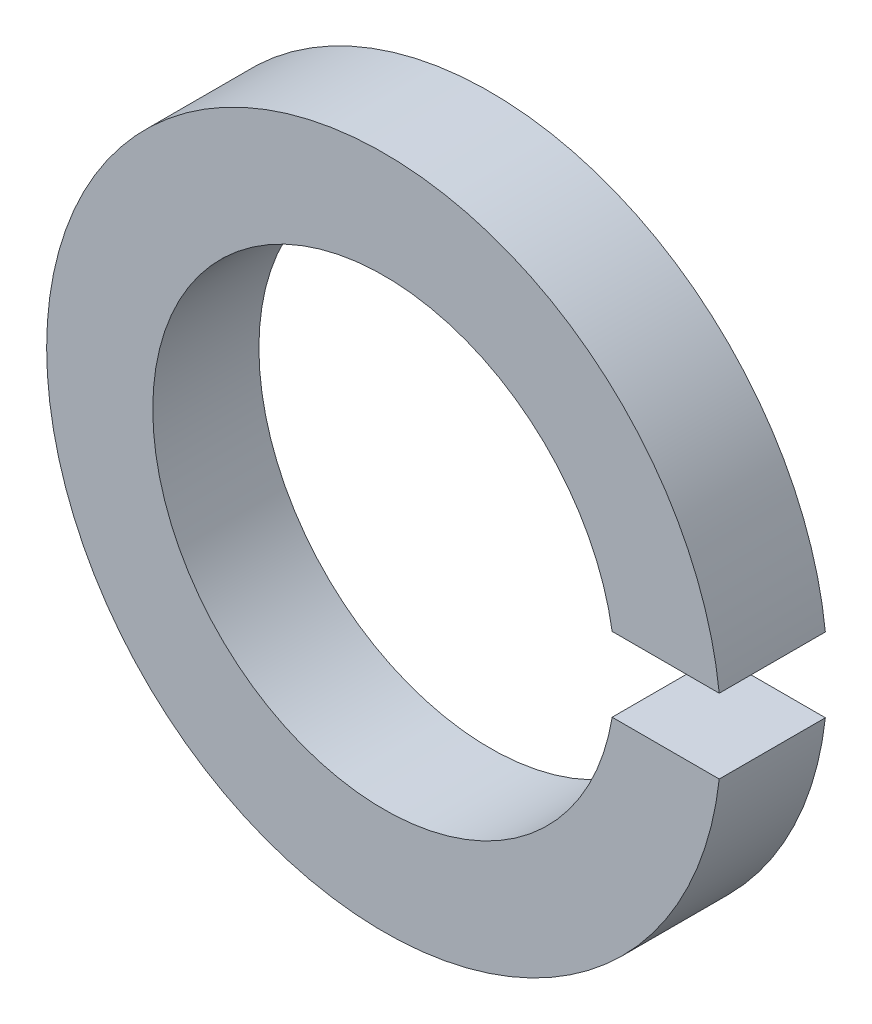
from build123d import *

# Parameters (mm, degrees)
SKETCH_1_R          = 4.45
SKETCH_1_R_2        = 3.05
EXTRUDE_1_DEPTH     = 1.4
SKETCH_2_W          = 1.528827716
SKETCH_2_H          = 0.98
CUT_EXTRUDE_1_DEPTH = 7.447092368


with BuildPart() as part:
    # Эскиз1 → Вытянуть1 (new body)
    with BuildSketch(Plane.XY):
        Circle(SKETCH_1_R)
        Circle(SKETCH_1_R_2, mode=Mode.SUBTRACT)
    extrude(amount=EXTRUDE_1_DEPTH)

    # Эскиз2 → Вырез-Вытянуть1 (cut, through all)
    with BuildSketch(Plane.XY.offset(1.4)):
        with Locations((3.759899488, 0)):
            Rectangle(SKETCH_2_W, SKETCH_2_H)
    extrude(amount=-CUT_EXTRUDE_1_DEPTH, mode=Mode.SUBTRACT)


solid = part.part
